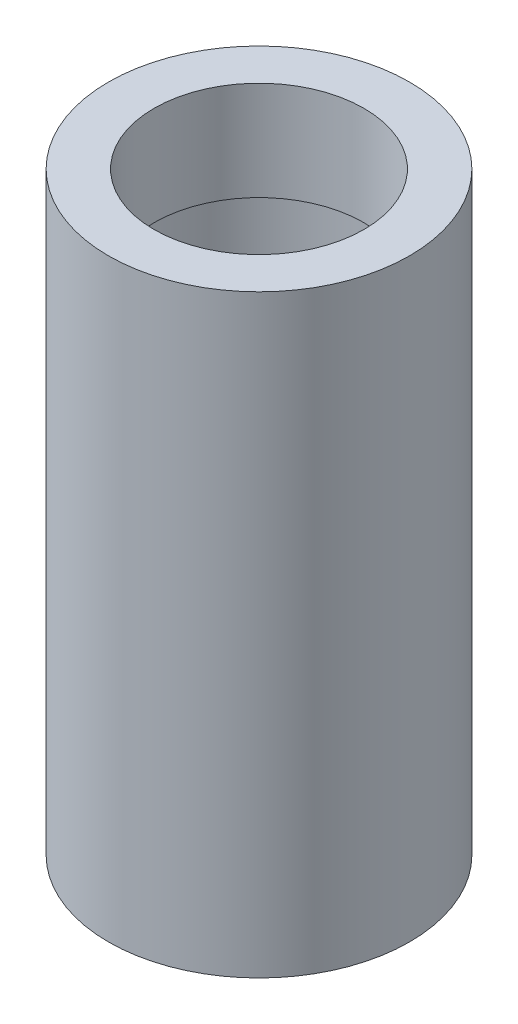
from build123d import *

# Parameters (mm, degrees)
CROQUIS1_R              = 3.8
CROQUIS1_R_2            = 3
SALIENTE_EXTRUIR1_DEPTH = 15
CROQUIS2_R              = 3.25
CROQUIS2_R_2            = 2.65
SALIENTE_EXTRUIR2_DEPTH = 2.5
REDONDEO1_R             = 0.3


with BuildPart() as part:
    # Croquis1 → Saliente-Extruir1 (new body)
    with BuildSketch(Plane(origin=(0, 0, 0), x_dir=(1, 0, 0), z_dir=(0, 1, 0))):
        with Locations(Location((0, 0, 0), (0, 0, 270))):
            Circle(CROQUIS1_R)
        with Locations(Location((0, 0, 0), (0, 0, 270))):
            Circle(CROQUIS1_R_2, mode=Mode.SUBTRACT)
    extrude(amount=SALIENTE_EXTRUIR1_DEPTH)

    # Croquis2 → Saliente-Extruir2 (add)
    with BuildSketch(Plane(origin=(0, 15, 0), x_dir=(1, 0, 0), z_dir=(0, 1, 0))):
        Circle(CROQUIS2_R)
        with Locations(Location((0, 0, 0), (0, 0, 270))):
            Circle(CROQUIS2_R_2, mode=Mode.SUBTRACT)
    extrude(amount=-SALIENTE_EXTRUIR2_DEPTH)

    # Redondeo1
    redondeo1_edges = [part.edges().sort_by_distance(p)[0] for p in [
        (0, 0, -3),
    ]]
    fillet(redondeo1_edges, radius=REDONDEO1_R)


solid = part.part
